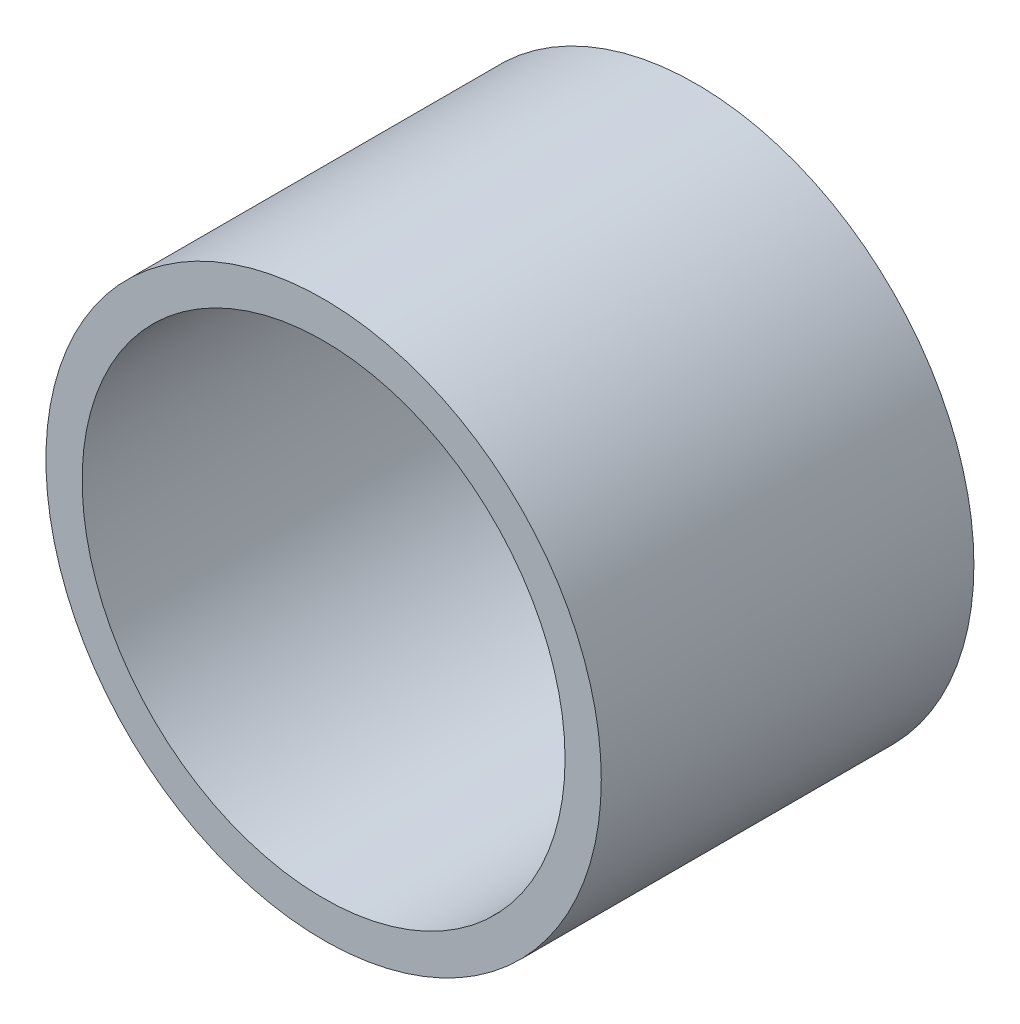
from build123d import *

# Parameters (mm, degrees)
SKETCH1_R           = 50.6
SKETCH1_R_2         = 44
BOSS_EXTRUDE1_DEPTH = 67.9


with BuildPart() as part:
    # Sketch1 → Boss-Extrude1 (new body)
    with BuildSketch(Plane.XY):
        Circle(SKETCH1_R)
        Circle(SKETCH1_R_2, mode=Mode.SUBTRACT)
    extrude(amount=BOSS_EXTRUDE1_DEPTH)


solid = part.part
